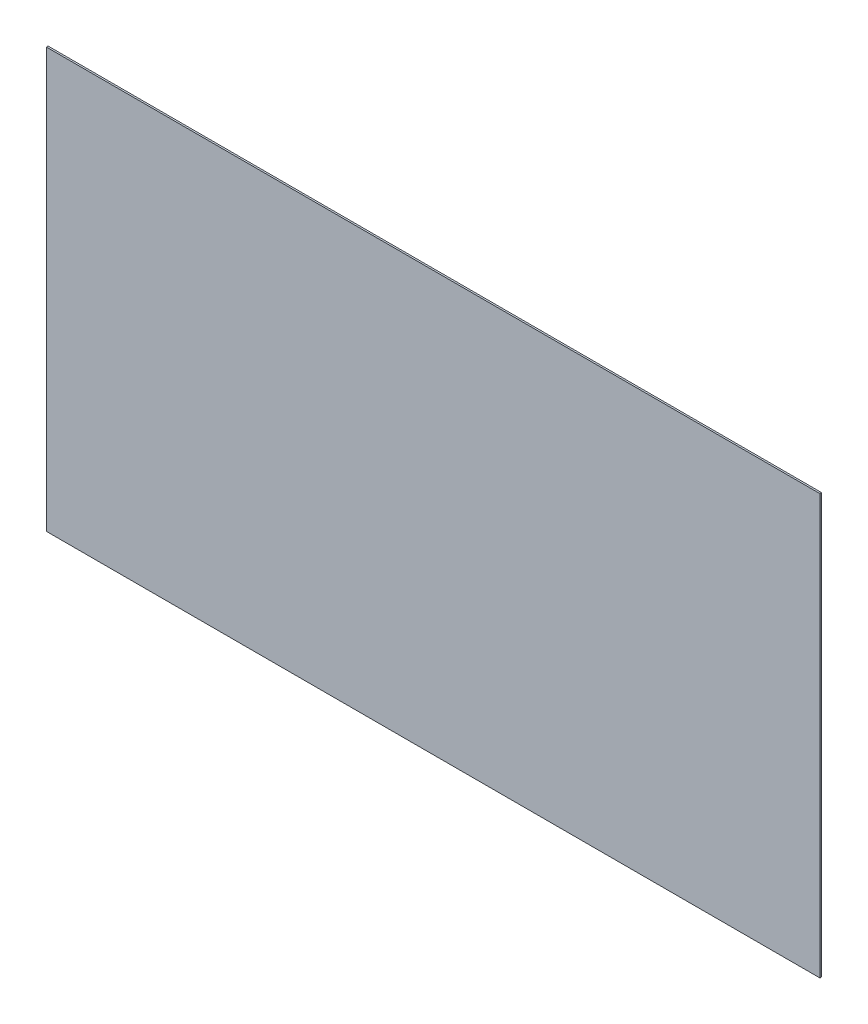
from build123d import *

# Parameters (mm, degrees)
SKETCH1_W           = 450
SKETCH1_H           = 244
BOSS_EXTRUDE1_DEPTH = 1


with BuildPart() as part:
    # Sketch1 → Boss-Extrude1 (new body)
    with BuildSketch(Plane.XY):
        Rectangle(SKETCH1_W, SKETCH1_H)
    extrude(amount=BOSS_EXTRUDE1_DEPTH)


solid = part.part
